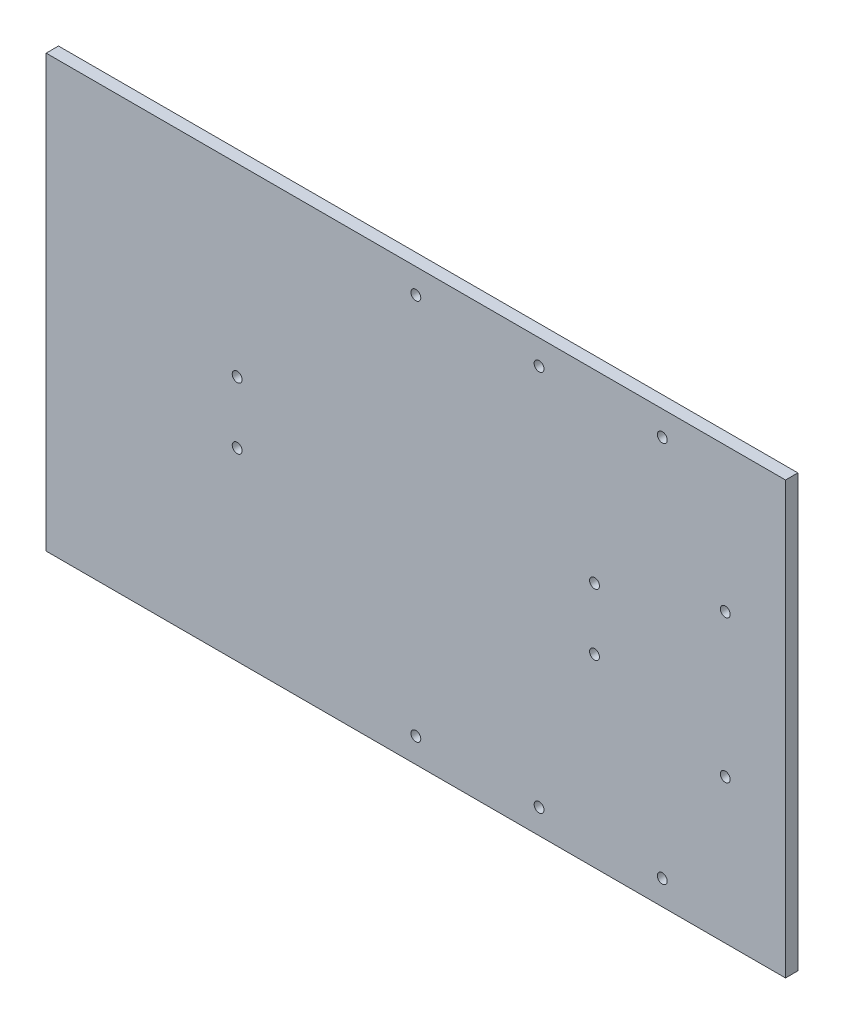
from build123d import *

# Parameters (mm, degrees)
SKETCH1_W           = 600
SKETCH1_H           = 350
BOSS_EXTRUDE1_DEPTH = 10
SKETCH2_R           = 4
CUT_EXTRUDE1_DEPTH  = 10
SKETCH9_R           = 4
CUT_EXTRUDE4_DEPTH  = 695.694177318
CUT_EXTRUDE5_REACH  = 696.694
SKETCH4_R           = 4


with BuildPart() as part:
    # Sketch1 → Boss-Extrude1 (new body)
    with BuildSketch(Plane.XY):
        with Locations((-300, 175)):
            Rectangle(SKETCH1_W, SKETCH1_H)
    extrude(amount=BOSS_EXTRUDE1_DEPTH)

    # Sketch2 → Cut-Extrude1 (cut)
    with BuildSketch(Plane(origin=(0, 0, 0), x_dir=(-1, 0, 0), z_dir=(0, 0, -1))):
        with Locations((100, 330)):
            Circle(SKETCH2_R)
        with Locations((200, 330)):
            Circle(SKETCH2_R)
        with Locations((300, 330)):
            Circle(SKETCH2_R)
        with Locations(Location((300, 20, 0), (0, 0, 180))):
            Circle(SKETCH2_R)
        with Locations(Location((200, 20, 0), (0, 0, 180))):
            Circle(SKETCH2_R)
        with Locations(Location((100, 20, 0), (0, 0, 180))):
            Circle(SKETCH2_R)
    extrude(amount=-CUT_EXTRUDE1_DEPTH, mode=Mode.SUBTRACT)

    # Sketch9 → Cut-Extrude4 (cut, through all)
    with BuildSketch(Plane(origin=(0, 0, 0), x_dir=(-1, 0, 0), z_dir=(0, 0, -1))):
        with Locations((48.91459754, 233)):
            Circle(SKETCH9_R)
        with Locations(Location((48.91459754, 117, 0), (0, 0, 180))):
            Circle(SKETCH9_R)
    extrude(amount=-CUT_EXTRUDE4_DEPTH, mode=Mode.SUBTRACT)

    # Sketch4 → Cut-Extrude5 (cut, up to next)
    with BuildSketch(Plane(origin=(0, 0, 0), x_dir=(-1, 0, 0), z_dir=(0, 0, -1)), mode=Mode.PRIVATE) as cut_extrude5_sk1:
        with Locations((155, 150)):
            Circle(SKETCH4_R)
    cut_extrude5_tool1 = extrude(cut_extrude5_sk1.sketch, amount=-CUT_EXTRUDE5_REACH, mode=Mode.PRIVATE) & part.part
    # Sketch4 → Cut-Extrude5 (cut, up to next)
    with BuildSketch(Plane(origin=(0, 0, 0), x_dir=(-1, 0, 0), z_dir=(0, 0, -1)), mode=Mode.PRIVATE) as cut_extrude5_sk2:
        with Locations(Location((155, 200, 0), (0, 0, 180))):
            Circle(SKETCH4_R)
    cut_extrude5_tool2 = extrude(cut_extrude5_sk2.sketch, amount=-CUT_EXTRUDE5_REACH, mode=Mode.PRIVATE) & part.part
    # Sketch4 → Cut-Extrude5 (cut, up to next)
    with BuildSketch(Plane(origin=(0, 0, 0), x_dir=(-1, 0, 0), z_dir=(0, 0, -1)), mode=Mode.PRIVATE) as cut_extrude5_sk3:
        with Locations(Location((445, 150, 0), (0, 0, 180))):
            Circle(SKETCH4_R)
    cut_extrude5_tool3 = extrude(cut_extrude5_sk3.sketch, amount=-CUT_EXTRUDE5_REACH, mode=Mode.PRIVATE) & part.part
    # Sketch4 → Cut-Extrude5 (cut, up to next)
    with BuildSketch(Plane(origin=(0, 0, 0), x_dir=(-1, 0, 0), z_dir=(0, 0, -1)), mode=Mode.PRIVATE) as cut_extrude5_sk4:
        with Locations((445, 200)):
            Circle(SKETCH4_R)
    cut_extrude5_tool4 = extrude(cut_extrude5_sk4.sketch, amount=-CUT_EXTRUDE5_REACH, mode=Mode.PRIVATE) & part.part
    add(cut_extrude5_tool1.solids().sort_by_distance((-155, 150, 0))[0], mode=Mode.SUBTRACT)
    add(cut_extrude5_tool2.solids().sort_by_distance((-155, 200, 0))[0], mode=Mode.SUBTRACT)
    add(cut_extrude5_tool3.solids().sort_by_distance((-445, 150, 0))[0], mode=Mode.SUBTRACT)
    add(cut_extrude5_tool4.solids().sort_by_distance((-445, 200, 0))[0], mode=Mode.SUBTRACT)


solid = part.part
